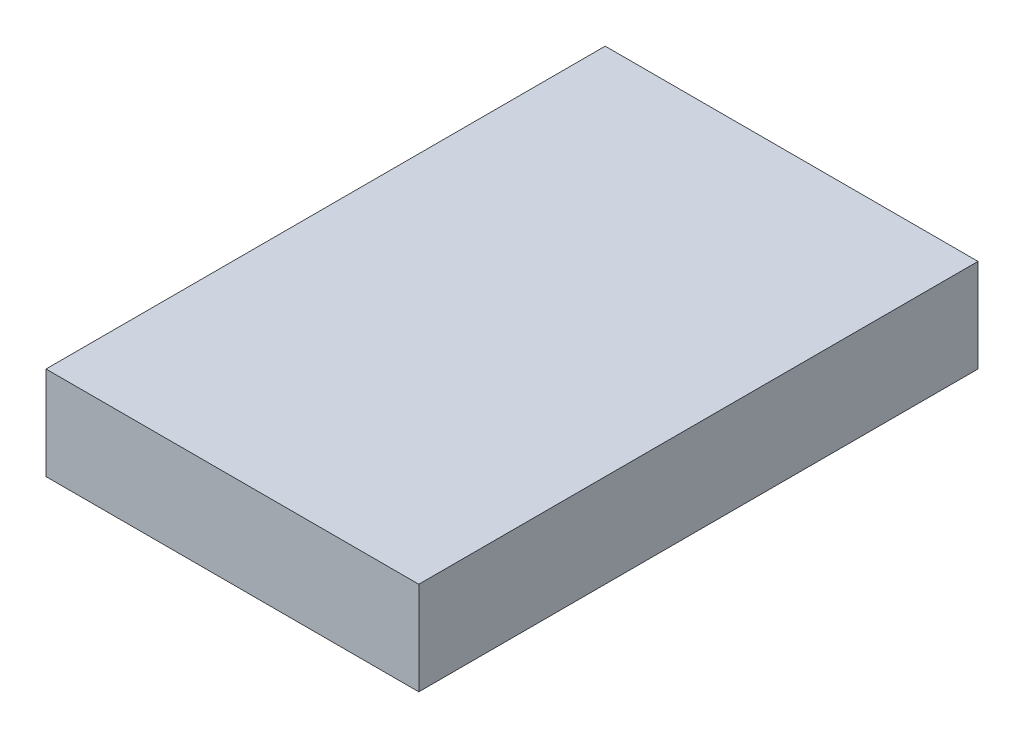
from build123d import *

# Parameters (mm, degrees)
SKETCH1_W           = 40
SKETCH1_H           = 10
BOSS_EXTRUDE1_DEPTH = 60
SKETCH10_R          = 0.5


with BuildPart() as part:
    # Sketch1 → Boss-Extrude1 (new body)
    with BuildSketch(Plane.XY):
        Rectangle(SKETCH1_W, SKETCH1_H)
    extrude(amount=BOSS_EXTRUDE1_DEPTH)

    # Cut-Sweep1: sweep along a path in Sketch2
    with BuildLine(Plane(origin=(0, 0, 0), x_dir=(1, 0, 0), z_dir=(0, 1, 0))) as cut_sweep1_path:
        Line((0, -50), (0, -46))
        ThreePointArc((0, -46), (0.292893219, -45.292893219), (1, -45))
        Line((1, -45), (15, -45))
        ThreePointArc((15, -45), (16.5, -43.5), (15, -42))
        Line((15, -42), (0, -42))
        Line((0, -42), (-15, -42))
        ThreePointArc((-15, -42), (-16.5, -40.5), (-15, -39))
        Line((-15, -39), (15, -39))
        ThreePointArc((15, -39), (16.5, -37.5), (15, -36))
        Line((15, -36), (-15, -36))
        ThreePointArc((-15, -36), (-16.5, -34.5), (-15, -33))
        Line((-15, -33), (15.355579664, -33))
        ThreePointArc((15.355579664, -33), (16.855579664, -31.5), (15.355579664, -30))
        Line((15.355579664, -30), (-15, -30))
        ThreePointArc((-15, -30), (-16.5, -28.5), (-15, -27))
        Line((-15, -27), (15, -27))
        ThreePointArc((15, -27), (16.5, -25.5), (15, -24))
        Line((15, -24), (-15, -24))
        ThreePointArc((-15, -24), (-16.5, -22.5), (-15, -21))
        Line((-15, -21), (15, -21))
        ThreePointArc((15, -21), (16.5, -19.5), (15, -18))
        Line((15, -18), (-15, -18))
        ThreePointArc((-15, -18), (-16.5, -16.5), (-15, -15))
        Line((-15, -15), (15, -15))
        ThreePointArc((15, -15), (16.5, -13.5), (15, -12))
        Line((15, -12), (1, -12))
        ThreePointArc((1, -12), (0.292893219, -11.707106781), (0, -11))
        Line((0, -11), (0, -6))
    # Sketch10 → Cut-Sweep1 (sweep, cut)
    with BuildSketch(Plane(origin=(0, 0, 6), x_dir=(-1, 0, 0), z_dir=(0, 0, -1))):
        Circle(SKETCH10_R)
    sweep(path=cut_sweep1_path.line, mode=Mode.SUBTRACT)


solid = part.part
